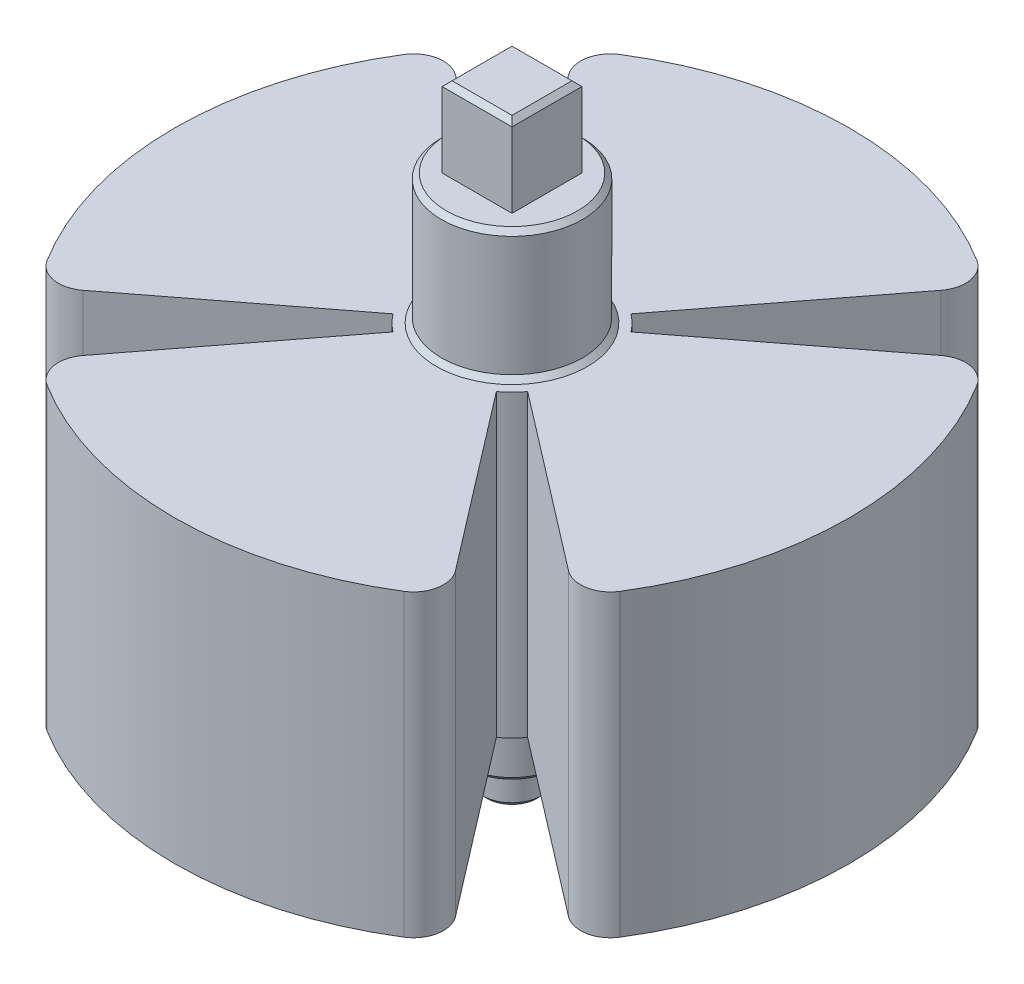
from build123d import *

# Parameters (mm, degrees)
SKETCH1_R           = 3.535533906
BOSS_EXTRUDE1_DEPTH = 6.5
SKETCH1_6_W         = 3.5
SKETCH1_6_H         = 3.5
BOSS_EXTRUDE2_DEPTH = 4
SKETCH4_R           = 4.25
BOSS_EXTRUDE5_DEPTH = 15
SKETCH2_R           = 2.5
BOSS_EXTRUDE3_DEPTH = 3.2
SKETCH3_R           = 1.5
BOSS_EXTRUDE4_DEPTH = 1.8
BOSS_EXTRUDE6_DEPTH = 15
CHAMFER1_SIZE       = 0.25


with BuildPart() as part:
    # Sketch1 → Boss-Extrude1 (new body)
    with BuildSketch(Plane(origin=(0, 0, 0), x_dir=(1, 0, 0), z_dir=(0, 1, 0))):
        with Locations(Location((0, 0, 0), (0, 0, 270))):
            Circle(SKETCH1_R)
    extrude(amount=-BOSS_EXTRUDE1_DEPTH)

    # Sketch1<6> → Boss-Extrude2 (add)
    with BuildSketch(Plane(origin=(0, 0, 0), x_dir=(1, 0, 0), z_dir=(0, 1, 0))):
        Rectangle(SKETCH1_6_W, SKETCH1_6_H)
    extrude(amount=BOSS_EXTRUDE2_DEPTH)

    # Sketch4 → Boss-Extrude5 (add)
    with BuildSketch(Plane.XZ.offset(6.5)):
        with Locations(Location((0, 0, 0), (0, 0, 270))):
            Circle(SKETCH4_R)
    extrude(amount=BOSS_EXTRUDE5_DEPTH)

    # Sketch2 → Boss-Extrude3 (add)
    with BuildSketch(Plane.XZ.offset(21.5)):
        with Locations(Location((0, 0, 0), (0, 0, 270))):
            Circle(SKETCH2_R)
    extrude(amount=BOSS_EXTRUDE3_DEPTH)

    # Sketch3 → Boss-Extrude4 (add)
    with BuildSketch(Plane.XZ.offset(24.7)):
        with Locations(Location((0, 0, 0), (0, 0, 270))):
            Circle(SKETCH3_R)
    extrude(amount=BOSS_EXTRUDE4_DEPTH)

    # Sketch5 → Boss-Extrude6 (add)
    with BuildSketch(Plane(origin=(0, -6.5, 0), x_dir=(1, 0, 0), z_dir=(0, 1, 0))):
        with BuildLine():
            Line((-9.330348818, 12.159547317), (-1.19003001, 1.550877304))
            ThreePointArc((-1.19003001, 1.550877304), (0, 0.964019448), (1.19003001, 1.550877304))
            Line((1.19003001, 1.550877304), (9.330348818, 12.159547317))
            ThreePointArc((9.330348818, 12.159547317), (9.616170653, 13.340759097), (8.933207003, 14.346003368))
            ThreePointArc((8.933207003, 14.346003368), (0, 16.9), (-8.933207003, 14.346003368))
            ThreePointArc((-8.933207003, 14.346003368), (-9.616170653, 13.340759097), (-9.330348818, 12.159547317))
        make_face()
        with BuildLine():
            Line((12.159547317, 9.330348818), (1.550877304, 1.19003001))
            ThreePointArc((1.550877304, 1.19003001), (0.964019448, 0), (1.550877304, -1.19003001))
            Line((1.550877304, -1.19003001), (12.159547317, -9.330348818))
            ThreePointArc((12.159547317, -9.330348818), (13.340759097, -9.616170653), (14.346003368, -8.933207003))
            ThreePointArc((14.346003368, -8.933207003), (16.9, 0), (14.346003368, 8.933207003))
            ThreePointArc((14.346003368, 8.933207003), (13.340759097, 9.616170653), (12.159547317, 9.330348818))
        make_face()
        with BuildLine():
            Line((9.330348818, -12.159547317), (1.19003001, -1.550877304))
            ThreePointArc((1.19003001, -1.550877304), (0, -0.964019448), (-1.19003001, -1.550877304))
            Line((-1.19003001, -1.550877304), (-9.330348818, -12.159547317))
            ThreePointArc((-9.330348818, -12.159547317), (-9.616170653, -13.340759097), (-8.933207003, -14.346003368))
            ThreePointArc((-8.933207003, -14.346003368), (0, -16.9), (8.933207003, -14.346003368))
            ThreePointArc((8.933207003, -14.346003368), (9.616170653, -13.340759097), (9.330348818, -12.159547317))
        make_face()
        with BuildLine():
            Line((-12.159547317, -9.330348818), (-1.550877304, -1.19003001))
            ThreePointArc((-1.550877304, -1.19003001), (-0.964019448, 0), (-1.550877304, 1.19003001))
            Line((-1.550877304, 1.19003001), (-12.159547317, 9.330348818))
            ThreePointArc((-12.159547317, 9.330348818), (-13.340759097, 9.616170653), (-14.346003368, 8.933207003))
            ThreePointArc((-14.346003368, 8.933207003), (-16.9, 0), (-14.346003368, -8.933207003))
            ThreePointArc((-14.346003368, -8.933207003), (-13.340759097, -9.616170653), (-12.159547317, -9.330348818))
        make_face()
    extrude(amount=-BOSS_EXTRUDE6_DEPTH)

    # Chamfer1
    chamfer1_edges = [part.edges().sort_by_distance(p)[0] for p in [
        (0, -6.5, -3.535533906),
        (0, 0, -3.535533906),
        (0, -21.5, 2.5),
        (0, -24.7, 2.5),
        (0, -24.7, 1.5),
        (0, -26.5, 1.5),
        (1.75, 4, 0),
        (0, 4, -1.75),
        (-1.75, 4, 0),
        (0, 4, 1.75),
    ]]
    chamfer(chamfer1_edges, length=CHAMFER1_SIZE)


solid = part.part
